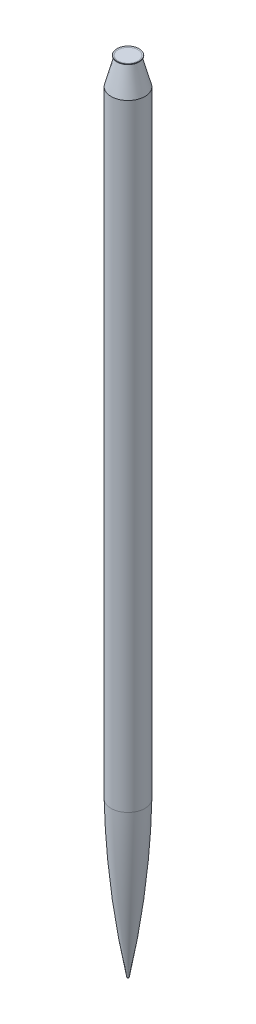
from build123d import *


with BuildPart() as part:
    # Sketch2 → Revolve1 (revolve)
    with BuildSketch(Plane.XY):
        with BuildLine():
            Line((0, 1266.19), (0, 6.753760064))
            ThreePointArc((0, 6.753760064), (1.004358981, 7.115605787), (1.547169826, 8.034858568))
            ThreePointArc((1.547169826, 8.034858568), (20.581846727, 138.066176315), (28.575, 269.24))
            Line((28.575, 269.24), (28.575, 1266.19))
            Line((28.575, 1266.19), (0, 1266.19))
        make_face()
    revolve(axis=Axis((0, 0, 0), (0, 1, 0)))

    # Sketch3 → Revolve2 (revolve)
    with BuildSketch(Plane.XY):
        with BuildLine():
            Line((-28.575, 1312.926), (-28.575, 1266.19))
            Line((-28.575, 1266.19), (0, 1266.19))
            Line((0, 1266.19), (0, 1358.9))
            Line((0, 1358.9), (-16.6116, 1358.9))
            Line((-16.6116, 1358.9), (-18.669, 1359.451278669))
            Line((-18.669, 1359.451278669), (-18.872794116, 1358.690708673))
            Line((-18.872794116, 1358.690708673), (-17.219933754, 1358.247826074))
            ThreePointArc((-17.219933754, 1358.247826074), (-16.757242508, 1357.892790594), (-16.681118386, 1357.314570482))
            Line((-16.681118386, 1357.314570482), (-28.575, 1312.926))
        make_face()
    revolve(axis=Axis((0, 1358.9, 0), (0, -1, 0)))


solid = part.part
